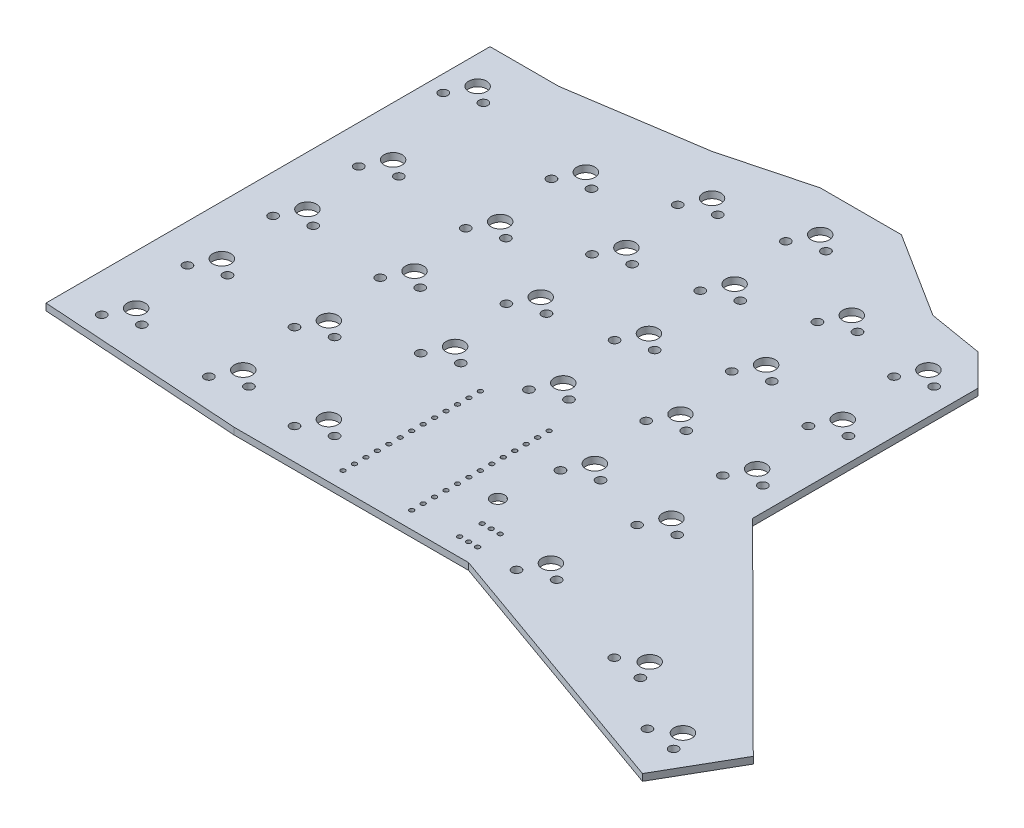
from build123d import *

# Parameters (mm, degrees)
MAIN_PLATE_DEPTH         = 1.5
SKETCH3_R                = 2
SWITCH_HOLES_MAIN_DEPTH  = 173.016549958
SKETCH4_R                = 1
SWITCH_HOLES_DEPTH       = 173.016549958
SKETCH2_R                = 0.5
SKETCH2_R_2              = 1.5
NICE_NANO_HOLES_DEPTH    = 173.016549958
SKETCH5_R                = 0.5
POWER_SWITCH_HOLES_DEPTH = 173.016549958


with BuildPart() as part:
    # Sketch1 → Main_plate (new body)
    with BuildSketch(Plane(origin=(0, 0, 0), x_dir=(1, 0, 0), z_dir=(0, 1, 0))):
        Polygon((87, 18), (94, 11), (94, -39), (139.782620217, -84.636279582), (130.810886505, -100.241022266), (71, -79), (19, -79), (-25.75, -76), (-25.75, 22.5), (-10.5, 22.5), (19, 27), (38, 32), (56, 32), (75, 20), align=None)
    extrude(amount=-MAIN_PLATE_DEPTH)

    # Sketch3 → Switch_holes_main (cut, through all)
    with BuildSketch(Plane(origin=(0, 0, 0), x_dir=(1, 0, 0), z_dir=(0, 1, 0))):
        with Locations(Location((-19.5, 13.5, 0), (0, 0, 270))):
            Circle(SKETCH3_R)
        with Locations(Location((9, 9, 0), (0, 0, 270))):
            Circle(SKETCH3_R)
        with Locations(Location((28, 18, 0), (0, 0, 270))):
            Circle(SKETCH3_R)
        with Locations(Location((47, 23, 0), (0, 0, 270))):
            Circle(SKETCH3_R)
        with Locations(Location((66, 11, 0), (0, 0, 270))):
            Circle(SKETCH3_R)
        with Locations(Location((85, 9, 0), (0, 0, 270))):
            Circle(SKETCH3_R)
        with Locations(Location((-14.75, -10, 0), (0, 0, 270))):
            Circle(SKETCH3_R)
        with Locations(Location((9, -10, 0), (0, 0, 270))):
            Circle(SKETCH3_R)
        with Locations(Location((28, -1, 0), (0, 0, 270))):
            Circle(SKETCH3_R)
        with Locations(Location((47, 4, 0), (0, 0, 270))):
            Circle(SKETCH3_R)
        with Locations(Location((66, -8, 0), (0, 0, 270))):
            Circle(SKETCH3_R)
        with Locations(Location((85, -10, 0), (0, 0, 270))):
            Circle(SKETCH3_R)
        with Locations(Location((47, -15, 0), (0, 0, 270))):
            Circle(SKETCH3_R)
        with Locations(Location((-14.75, -29, 0), (0, 0, 270))):
            Circle(SKETCH3_R)
        with Locations(Location((-14.75, -48, 0), (0, 0, 270))):
            Circle(SKETCH3_R)
        with Locations(Location((-14.75, -67, 0), (0, 0, 270))):
            Circle(SKETCH3_R)
        with Locations(Location((9, -29, 0), (0, 0, 270))):
            Circle(SKETCH3_R)
        with Locations(Location((9, -48, 0), (0, 0, 270))):
            Circle(SKETCH3_R)
        with Locations(Location((9, -67, 0), (0, 0, 270))):
            Circle(SKETCH3_R)
        with Locations(Location((28, -67, 0), (0, 0, 270))):
            Circle(SKETCH3_R)
        with Locations(Location((28, -39, 0), (0, 0, 270))):
            Circle(SKETCH3_R)
        with Locations(Location((28, -20, 0), (0, 0, 270))):
            Circle(SKETCH3_R)
        with Locations(Location((47, -34, 0), (0, 0, 270))):
            Circle(SKETCH3_R)
        with Locations(Location((66, -27, 0), (0, 0, 270))):
            Circle(SKETCH3_R)
        with Locations(Location((85, -29, 0), (0, 0, 270))):
            Circle(SKETCH3_R)
        with Locations(Location((85, -48, 0), (0, 0, 270))):
            Circle(SKETCH3_R)
        with Locations(Location((66, -46, 0), (0, 0, 270))):
            Circle(SKETCH3_R)
        with Locations(Location((80.25, -70, 0), (0, 0, 270))):
            Circle(SKETCH3_R)
        with Locations(Location((110.155779038, -77.984191056, 0), (0, 0, 270))):
            Circle(SKETCH3_R)
        with Locations(Location((127.494382019, -87.952784068, 0), (0, 0, 270))):
            Circle(SKETCH3_R)
    extrude(amount=-SWITCH_HOLES_MAIN_DEPTH, mode=Mode.SUBTRACT)

    # Sketch4 → Switch_holes (cut, through all)
    with BuildSketch(Plane(origin=(0, 0, 0), x_dir=(1, 0, 0), z_dir=(0, 1, 0))):
        with Locations(Location((-22.04, 8.42, 0), (0, 0, 270))):
            Circle(SKETCH4_R)
        with Locations(Location((-15.69, 10.96, 0), (0, 0, 270))):
            Circle(SKETCH4_R)
        with Locations(Location((-10.94, -12.54, 0), (0, 0, 270))):
            Circle(SKETCH4_R)
        with Locations(Location((-17.29, -15.08, 0), (0, 0, 270))):
            Circle(SKETCH4_R)
        with Locations(Location((-10.94, -31.54, 0), (0, 0, 270))):
            Circle(SKETCH4_R)
        with Locations(Location((-17.29, -34.08, 0), (0, 0, 270))):
            Circle(SKETCH4_R)
        with Locations(Location((-10.94, -50.54, 0), (0, 0, 270))):
            Circle(SKETCH4_R)
        with Locations(Location((-17.29, -53.08, 0), (0, 0, 270))):
            Circle(SKETCH4_R)
        with Locations(Location((-17.29, -72.08, 0), (0, 0, 270))):
            Circle(SKETCH4_R)
        with Locations(Location((-10.94, -69.54, 0), (0, 0, 270))):
            Circle(SKETCH4_R)
        with Locations(Location((6.46, -72.08, 0), (0, 0, 270))):
            Circle(SKETCH4_R)
        with Locations(Location((12.81, -69.54, 0), (0, 0, 270))):
            Circle(SKETCH4_R)
        with Locations(Location((25.46, -72.08, 0), (0, 0, 270))):
            Circle(SKETCH4_R)
        with Locations(Location((31.81, -69.54, 0), (0, 0, 270))):
            Circle(SKETCH4_R)
        with Locations(Location((6.46, -53.08, 0), (0, 0, 270))):
            Circle(SKETCH4_R)
        with Locations(Location((12.81, -50.54, 0), (0, 0, 270))):
            Circle(SKETCH4_R)
        with Locations(Location((6.46, -34.08, 0), (0, 0, 270))):
            Circle(SKETCH4_R)
        with Locations(Location((12.81, -31.54, 0), (0, 0, 270))):
            Circle(SKETCH4_R)
        with Locations(Location((25.46, -44.08, 0), (0, 0, 270))):
            Circle(SKETCH4_R)
        with Locations(Location((31.81, -41.54, 0), (0, 0, 270))):
            Circle(SKETCH4_R)
        with Locations(Location((25.46, -25.08, 0), (0, 0, 270))):
            Circle(SKETCH4_R)
        with Locations(Location((31.81, -22.54, 0), (0, 0, 270))):
            Circle(SKETCH4_R)
        with Locations(Location((6.46, -15.08, 0), (0, 0, 270))):
            Circle(SKETCH4_R)
        with Locations(Location((12.81, -12.54, 0), (0, 0, 270))):
            Circle(SKETCH4_R)
        with Locations(Location((6.46, 3.92, 0), (0, 0, 270))):
            Circle(SKETCH4_R)
        with Locations(Location((12.81, 6.46, 0), (0, 0, 270))):
            Circle(SKETCH4_R)
        with Locations(Location((25.46, 12.92, 0), (0, 0, 270))):
            Circle(SKETCH4_R)
        with Locations(Location((31.81, 15.46, 0), (0, 0, 270))):
            Circle(SKETCH4_R)
        with Locations(Location((25.46, -6.08, 0), (0, 0, 270))):
            Circle(SKETCH4_R)
        with Locations(Location((31.81, -3.54, 0), (0, 0, 270))):
            Circle(SKETCH4_R)
        with Locations(Location((44.46, 17.92, 0), (0, 0, 270))):
            Circle(SKETCH4_R)
        with Locations(Location((50.81, 20.46, 0), (0, 0, 270))):
            Circle(SKETCH4_R)
        with Locations(Location((44.46, -1.08, 0), (0, 0, 270))):
            Circle(SKETCH4_R)
        with Locations(Location((50.81, 1.46, 0), (0, 0, 270))):
            Circle(SKETCH4_R)
        with Locations(Location((44.46, -20.08, 0), (0, 0, 270))):
            Circle(SKETCH4_R)
        with Locations(Location((50.81, -17.54, 0), (0, 0, 270))):
            Circle(SKETCH4_R)
        with Locations(Location((44.46, -39.08, 0), (0, 0, 270))):
            Circle(SKETCH4_R)
        with Locations(Location((50.81, -36.54, 0), (0, 0, 270))):
            Circle(SKETCH4_R)
        with Locations(Location((69.81, 8.46, 0), (0, 0, 270))):
            Circle(SKETCH4_R)
        with Locations(Location((63.46, 5.92, 0), (0, 0, 270))):
            Circle(SKETCH4_R)
        with Locations(Location((82.46, 3.92, 0), (0, 0, 270))):
            Circle(SKETCH4_R)
        with Locations(Location((88.81, 6.46, 0), (0, 0, 270))):
            Circle(SKETCH4_R)
        with Locations(Location((69.81, -10.54, 0), (0, 0, 270))):
            Circle(SKETCH4_R)
        with Locations(Location((63.46, -13.08, 0), (0, 0, 270))):
            Circle(SKETCH4_R)
        with Locations(Location((82.46, -15.08, 0), (0, 0, 270))):
            Circle(SKETCH4_R)
        with Locations(Location((88.81, -12.54, 0), (0, 0, 270))):
            Circle(SKETCH4_R)
        with Locations(Location((63.46, -32.08, 0), (0, 0, 270))):
            Circle(SKETCH4_R)
        with Locations(Location((69.81, -29.54, 0), (0, 0, 270))):
            Circle(SKETCH4_R)
        with Locations(Location((63.46, -51.08, 0), (0, 0, 270))):
            Circle(SKETCH4_R)
        with Locations(Location((69.81, -48.54, 0), (0, 0, 270))):
            Circle(SKETCH4_R)
        with Locations(Location((82.46, -34.08, 0), (0, 0, 270))):
            Circle(SKETCH4_R)
        with Locations(Location((88.81, -31.54, 0), (0, 0, 270))):
            Circle(SKETCH4_R)
        with Locations(Location((88.81, -50.54, 0), (0, 0, 270))):
            Circle(SKETCH4_R)
        with Locations(Location((82.46, -53.08, 0), (0, 0, 270))):
            Circle(SKETCH4_R)
        with Locations(Location((77.71, -75.08, 0), (0, 0, 270))):
            Circle(SKETCH4_R)
        with Locations(Location((84.06, -72.54, 0), (0, 0, 270))):
            Circle(SKETCH4_R)
        with Locations(Location((105.42167664, -81.122068441, 0), (0, 0, 270))):
            Circle(SKETCH4_R)
        with Locations(Location((112.192670707, -82.085260712, 0), (0, 0, 270))):
            Circle(SKETCH4_R)
        with Locations(Location((122.760279622, -91.090661454, 0), (0, 0, 270))):
            Circle(SKETCH4_R)
        with Locations(Location((129.531273688, -92.053853725, 0), (0, 0, 270))):
            Circle(SKETCH4_R)
    extrude(amount=-SWITCH_HOLES_DEPTH, mode=Mode.SUBTRACT)

    # Sketch2 → Nice_nano_holes (cut, through all)
    with BuildSketch(Plane(origin=(0, 0, 0), x_dir=(1, 0, 0), z_dir=(0, 1, 0))):
        with Locations(Location((39.38, -75.25, 0), (0, 0, 270))):
            Circle(SKETCH2_R)
        with Locations(Location((39.38, -72.71, 0), (0, 0, 270))):
            Circle(SKETCH2_R)
        with Locations(Location((39.38, -70.17, 0), (0, 0, 270))):
            Circle(SKETCH2_R)
        with Locations(Location((39.38, -67.63, 0), (0, 0, 270))):
            Circle(SKETCH2_R)
        with Locations(Location((39.38, -65.09, 0), (0, 0, 270))):
            Circle(SKETCH2_R)
        with Locations(Location((39.38, -62.55, 0), (0, 0, 270))):
            Circle(SKETCH2_R)
        with Locations(Location((39.38, -60.01, 0), (0, 0, 270))):
            Circle(SKETCH2_R)
        with Locations(Location((39.38, -57.47, 0), (0, 0, 270))):
            Circle(SKETCH2_R)
        with Locations(Location((39.38, -54.93, 0), (0, 0, 270))):
            Circle(SKETCH2_R)
        with Locations(Location((39.38, -52.39, 0), (0, 0, 270))):
            Circle(SKETCH2_R)
        with Locations(Location((39.38, -49.85, 0), (0, 0, 270))):
            Circle(SKETCH2_R)
        with Locations(Location((39.38, -47.31, 0), (0, 0, 270))):
            Circle(SKETCH2_R)
        with Locations(Location((39.38, -44.77, 0), (0, 0, 270))):
            Circle(SKETCH2_R)
        with Locations(Location((54.62, -44.77, 0), (0, 0, 90))):
            Circle(SKETCH2_R)
        with Locations(Location((54.62, -47.31, 0), (0, 0, 90))):
            Circle(SKETCH2_R)
        with Locations(Location((54.62, -49.85, 0), (0, 0, 90))):
            Circle(SKETCH2_R)
        with Locations(Location((54.62, -52.39, 0), (0, 0, 90))):
            Circle(SKETCH2_R)
        with Locations(Location((54.62, -54.93, 0), (0, 0, 90))):
            Circle(SKETCH2_R)
        with Locations(Location((54.62, -57.47, 0), (0, 0, 90))):
            Circle(SKETCH2_R)
        with Locations(Location((54.62, -60.01, 0), (0, 0, 90))):
            Circle(SKETCH2_R)
        with Locations(Location((54.62, -62.55, 0), (0, 0, 90))):
            Circle(SKETCH2_R)
        with Locations(Location((54.62, -65.09, 0), (0, 0, 90))):
            Circle(SKETCH2_R)
        with Locations(Location((54.62, -67.63, 0), (0, 0, 90))):
            Circle(SKETCH2_R)
        with Locations(Location((54.62, -70.17, 0), (0, 0, 90))):
            Circle(SKETCH2_R)
        with Locations(Location((54.62, -72.71, 0), (0, 0, 90))):
            Circle(SKETCH2_R)
        with Locations(Location((54.62, -75.25, 0), (0, 0, 90))):
            Circle(SKETCH2_R)
        with Locations(Location((62, -63.5, 0), (0, 0, 270))):
            Circle(SKETCH2_R_2)
    extrude(amount=-NICE_NANO_HOLES_DEPTH, mode=Mode.SUBTRACT)

    # Sketch5 → Power_switch_holes (cut, through all)
    with BuildSketch(Plane(origin=(0, 0, 0), x_dir=(1, 0, 0), z_dir=(0, 1, 0))):
        with Locations(Location((65, -75, 0), (0, 0, 270))):
            Circle(SKETCH5_R)
        with Locations(Location((67, -75, 0), (0, 0, 270))):
            Circle(SKETCH5_R)
        with Locations(Location((69, -75, 0), (0, 0, 270))):
            Circle(SKETCH5_R)
        with Locations(Location((65, -70, 0), (0, 0, 270))):
            Circle(SKETCH5_R)
        with Locations(Location((69, -70, 0), (0, 0, 270))):
            Circle(SKETCH5_R)
        with Locations(Location((67, -70, 0), (0, 0, 270))):
            Circle(SKETCH5_R)
    extrude(amount=-POWER_SWITCH_HOLES_DEPTH, mode=Mode.SUBTRACT)


solid = part.part
